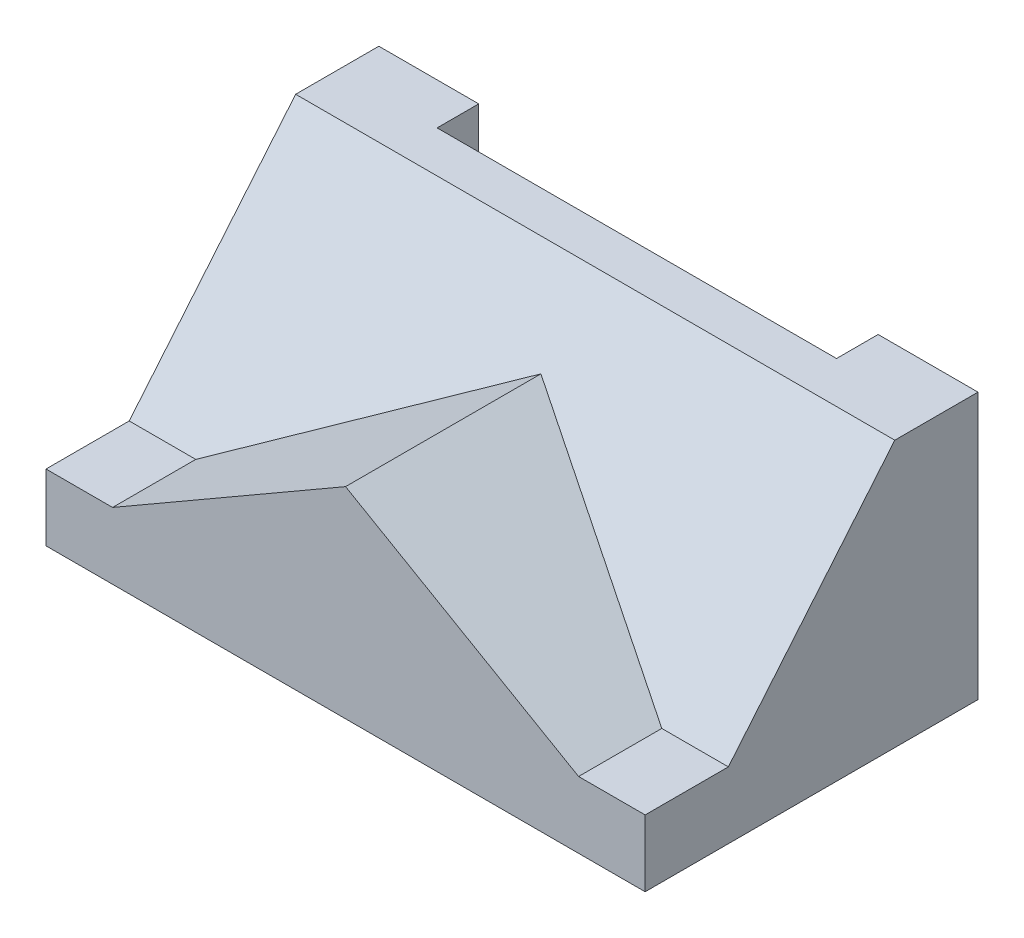
from build123d import *

# Parameters (mm, degrees)
EXTRUDE_1_DEPTH     = 36
EXTRUDE_2_REACH     = 64.61
SKETCH_3_W          = 48
SKETCH_3_H          = 5
CUT_EXTRUDE_1_DEPTH = 63.60990337


with BuildPart() as part:
    # 草圖1 → 填料-伸長1 (new, symmetric)
    with BuildSketch(Plane(origin=(0, 0, 0), x_dir=(0, 0, -1), z_dir=(1, 0, 0))):
        Polygon((0, 0), (40, 0), (40, 32), (30, 32), (10, 8), (0, 8), align=None)
    extrude(amount=EXTRUDE_1_DEPTH, both=True)

    # 填料-伸長2: up to this plane
    extrude_2_end = Plane(origin=(36, 32, -30), z_dir=(0, -0.6401843996644797, -0.768221279597376))
    # 草圖2 → 填料-伸長2 (add, up to the surface)
    with BuildSketch(Plane.XY, mode=Mode.PRIVATE) as extrude_2_sk1:
        Polygon((0, 24.165807537), (-28, 8), (28, 8), align=None)
    extrude_2_tool1 = split(extrude(extrude_2_sk1.sketch, amount=-EXTRUDE_2_REACH, mode=Mode.PRIVATE), bisect_by=extrude_2_end, keep=Keep.BOTH, mode=Mode.PRIVATE)
    add(extrude_2_tool1.solids().sort_by_distance((0, 13.388603, 0))[0])

    # 草圖3 → 除料-伸長1 (cut, through all)
    with BuildSketch(Plane(origin=(0, 32, 0), x_dir=(1, 0, 0), z_dir=(0, 1, 0))):
        with Locations((0, 37.5)):
            Rectangle(SKETCH_3_W, SKETCH_3_H)
    extrude(amount=-CUT_EXTRUDE_1_DEPTH, mode=Mode.SUBTRACT)


solid = part.part
